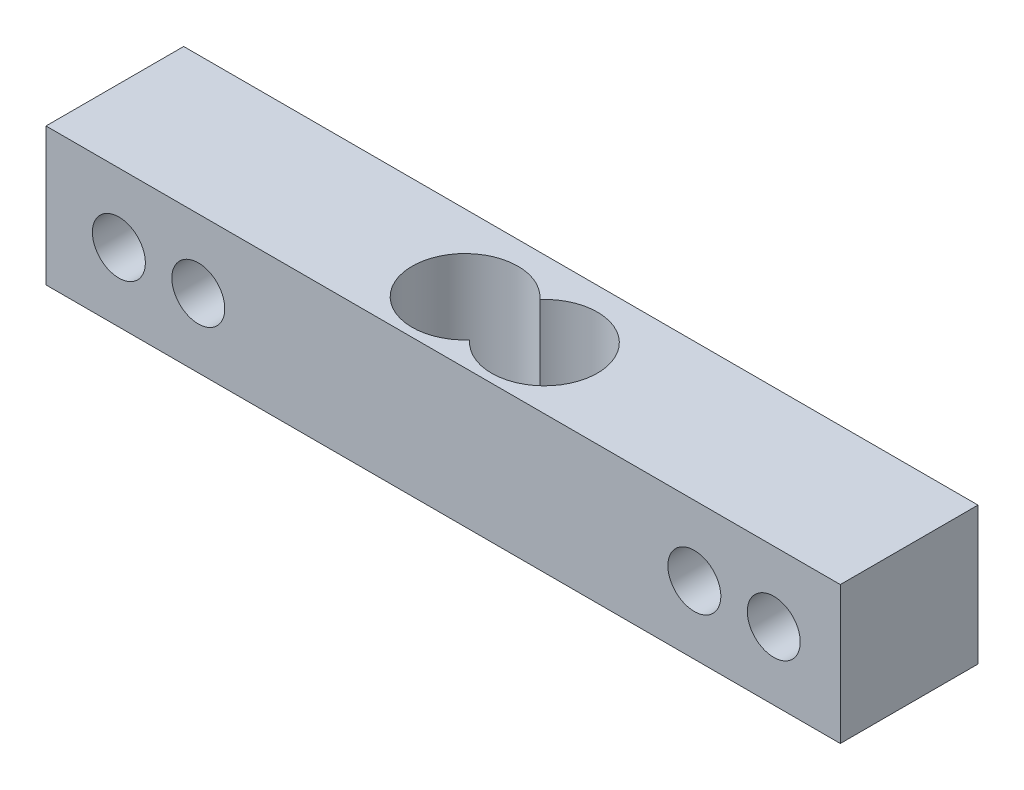
from build123d import *

# Parameters (mm, degrees)
SKETCH1_W           = 75
SKETCH1_H           = 13
BOSS_EXTRUDE1_DEPTH = 13
SKETCH3_R           = 2.5
CUT_EXTRUDE4_DEPTH  = 13
CUT_EXTRUDE5_DEPTH  = 13


with BuildPart() as part:
    # Sketch1 → Boss-Extrude1 (new body)
    with BuildSketch(Plane.XY):
        Rectangle(SKETCH1_W, SKETCH1_H)
    extrude(amount=BOSS_EXTRUDE1_DEPTH)

    # Sketch3 → Cut-Extrude4 (cut)
    with BuildSketch(Plane.XY):
        with Locations(Location((31.216304174, -0.096660898, 0), (0, 0, 180))):
            Circle(SKETCH3_R)
        with Locations(Location((23.716304174, -0.096660898, 0), (0, 0, 180))):
            Circle(SKETCH3_R)
        with Locations(Location((-23.119138504, 0.000687163, 0), (0, 0, 180))):
            Circle(SKETCH3_R)
        with Locations(Location((-30.619138504, 0.000687163, 0), (0, 0, 180))):
            Circle(SKETCH3_R)
    extrude(amount=CUT_EXTRUDE4_DEPTH, mode=Mode.SUBTRACT)

    # Sketch4 → Cut-Extrude5 (cut)
    with BuildSketch(Plane(origin=(0, 6.5, 0), x_dir=(1, 0, 0), z_dir=(0, 1, 0))):
        with BuildLine():
            ThreePointArc((0, -3.877187484), (-8.75, -7.184376623), (0, -10.491565762))
            ThreePointArc((0, -10.491565762), (8.75, -7.184376623), (0, -3.877187484))
        make_face()
    extrude(amount=-CUT_EXTRUDE5_DEPTH, mode=Mode.SUBTRACT)


solid = part.part
